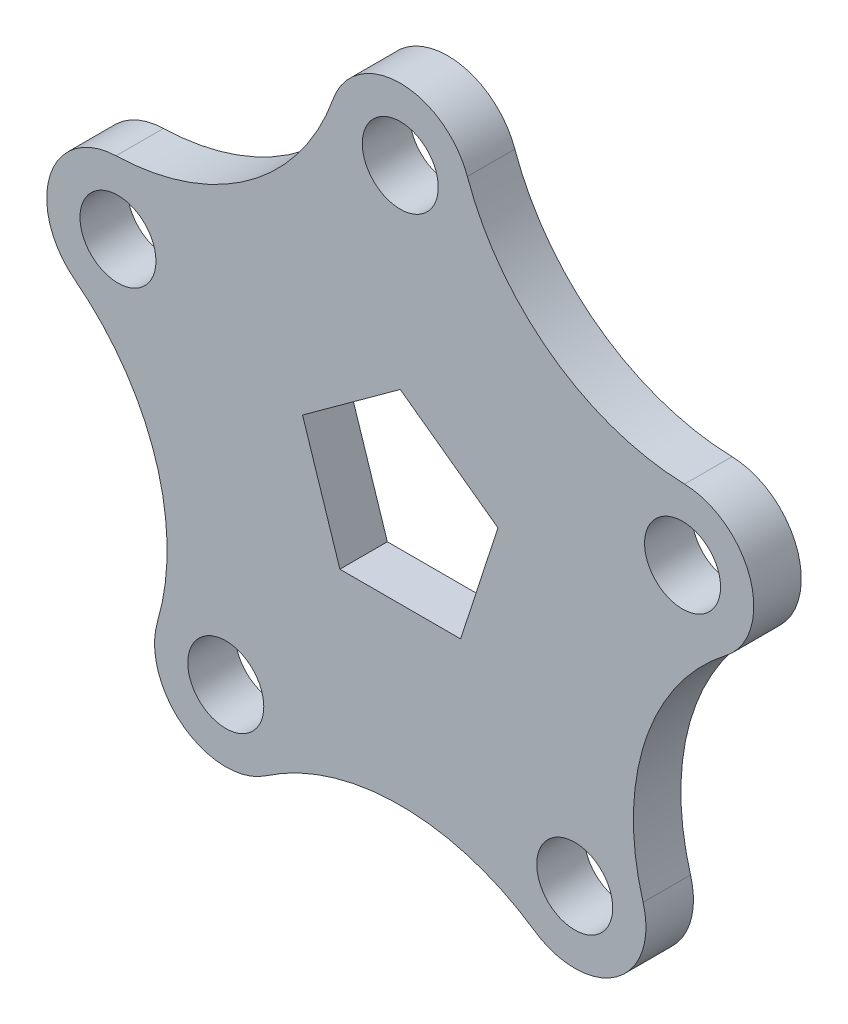
from build123d import *

# Parameters (mm, degrees)
DODANIE_WYCI_GNI_CIE1_DEPTH = 10


with BuildPart() as part:
    # Szkic1 → Dodanie-wyciągnięcie1 (new body)
    # profile 1 of 6: a face of its own
    with BuildSketch(Plane.XY):
        with BuildLine():
            ThreePointArc((49.451604439, -38.220267116), (51.534462525, -16.744561909), (62.47249774, 1.853921835))
            ThreePointArc((62.47249774, 1.853921835), (62.136733384, 6.728771384), (61.421159158, 11.562491416))
            ThreePointArc((61.421159158, 11.562491416), (51.832580138, 16.841426193), (56.487023507, 26.748199479))
            ThreePointArc((56.487023507, 26.748199479), (54.224745868, 31.079365108), (51.631020266, 35.220558574))
            ThreePointArc((51.631020266, 35.220558574), (31.850049433, 43.837832205), (17.541879041, 59.987769418))
            ThreePointArc((17.541879041, 59.987769418), (12.80186472, 61.174849895), (7.983599188, 61.988))
            ThreePointArc((7.983599188, 61.988), (0, 54.5), (-7.983599188, 61.988))
            ThreePointArc((-7.983599188, 61.988), (-12.80186472, 61.174849895), (-17.541879041, 59.987769418))
            ThreePointArc((-17.541879041, 59.987769418), (-31.850049433, 43.837832205), (-51.631020266, 35.220558574))
            ThreePointArc((-51.631020266, 35.220558574), (-54.224745868, 31.079365108), (-56.487023507, 26.748199479))
            ThreePointArc((-56.487023507, 26.748199479), (-52.821664093, 23.80621893), (-51.441032268, 19.313562148))
            ThreePointArc((-51.441032268, 19.313562148), (-54.533946326, 12.995294383), (-61.421159158, 11.562491416))
            ThreePointArc((-61.421159158, 11.562491416), (-62.136733384, 6.728771384), (-62.47249774, 1.853921835))
            ThreePointArc((-62.47249774, 1.853921835), (-51.534462525, -16.744561909), (-49.451604439, -38.220267116))
            ThreePointArc((-49.451604439, -38.220267116), (-46.314600697, -41.96674591), (-42.894499639, -45.456703584))
            ThreePointArc((-42.894499639, -45.456703584), (-34.022114322, -43.038159469), (-28.736578268, -50.563562148))
            ThreePointArc((-28.736578268, -50.563562148), (-29.052877736, -52.790835397), (-29.976764799, -54.84198731))
            ThreePointArc((-29.976764799, -54.84198731), (-25.600748462, -57.016240478), (-21.068247925, -58.841982711))
            ThreePointArc((-21.068247925, -58.841982711), (0, -54.186540592), (21.068247925, -58.841982711))
            ThreePointArc((21.068247925, -58.841982711), (25.600748462, -57.016240478), (29.976764799, -54.84198731))
            ThreePointArc((29.976764799, -54.84198731), (32.03429625, -44.091426193), (42.894499639, -45.456703584))
            ThreePointArc((42.894499639, -45.456703584), (46.314600697, -41.96674591), (49.451604439, -38.220267116))
        make_face()
        Polygon((-10.286241146, 14.15779796), (0, 21.631189606), (10.286241317, 14.157797836), (20.57248383, 6.684405197), (16.643488487, -5.40779909), (12.71449424, -17.5), (2.9e-08, -17.5), (-12.71449424, -17.5), (-16.643488373, -5.40779944), (-20.57248383, 6.684405197), align=None, mode=Mode.SUBTRACT)
    # profile 2 of 6: a face of its own
    with BuildSketch(Plane.XY):
        with BuildLine():
            ThreePointArc((-56.487023507, 26.748199479), (-54.224745868, 31.079365108), (-51.631020266, 35.220558574))
            ThreePointArc((-51.631020266, 35.220558574), (-55.724604264, 34.593732502), (-59.85601991, 34.307820558))
            ThreePointArc((-59.85601991, 34.307820558), (-73.706880013, 23.948817064), (-68.590168285, 7.426875892))
            ThreePointArc((-68.590168285, 7.426875892), (-65.415837641, 4.767183084), (-62.47249774, 1.853921835))
            ThreePointArc((-62.47249774, 1.853921835), (-62.136733384, 6.728771384), (-61.421159158, 11.562491416))
            ThreePointArc((-61.421159158, 11.562491416), (-67.049484399, 21.785698103), (-56.487023507, 26.748199479))
        make_face()
    # profile 3 of 6: a face of its own
    with BuildSketch(Plane.XY):
        with BuildLine():
            ThreePointArc((7.983599188, 61.988), (12.80186472, 61.174849895), (17.541879041, 59.987769418))
            ThreePointArc((17.541879041, 59.987769418), (15.680744996, 63.687299245), (14.132148934, 67.528157367))
            ThreePointArc((14.132148934, 67.528157367), (0, 77.5), (-14.132148934, 67.528157367))
            ThreePointArc((-14.132148934, 67.528157367), (-15.680744996, 63.687299245), (-17.541879041, 59.987769418))
            ThreePointArc((-17.541879041, 59.987769418), (-12.80186472, 61.174849895), (-7.983599188, 61.988))
            ThreePointArc((-7.983599188, 61.988), (-0.256131307, 70.495898746), (8, 62.5))
            ThreePointArc((8, 62.5), (7.995898746, 62.243868693), (7.983599188, 61.988))
        make_face()
    # profile 4 of 6: a face of its own
    with BuildSketch(Plane.XY):
        with BuildLine():
            ThreePointArc((61.421159158, 11.562491416), (62.136733384, 6.728771384), (62.47249774, 1.853921835))
            ThreePointArc((62.47249774, 1.853921835), (65.415837641, 4.767183084), (68.590168285, 7.426875892))
            ThreePointArc((68.590168285, 7.426875892), (73.706880013, 23.948817064), (59.85601991, 34.307820558))
            ThreePointArc((59.85601991, 34.307820558), (55.724604264, 34.593732502), (51.631020266, 35.220558574))
            ThreePointArc((51.631020266, 35.220558574), (54.224745868, 31.079365108), (56.487023507, 26.748199479))
            ThreePointArc((56.487023507, 26.748199479), (63.93368905, 25.932930324), (67.441032268, 19.313562148))
            ThreePointArc((67.441032268, 19.313562148), (65.759300034, 14.406476206), (61.421159158, 11.562491416))
        make_face()
    # profile 5 of 6: a face of its own
    with BuildSketch(Plane.XY):
        with BuildLine():
            ThreePointArc((51.125203669, -46.324758182), (50.120444441, -42.307196762), (49.451604439, -38.220267116))
            ThreePointArc((49.451604439, -38.220267116), (46.314600697, -41.96674591), (42.894499639, -45.456703584))
            ThreePointArc((42.894499639, -45.456703584), (44.261980947, -47.849098202), (44.736578268, -50.563562148))
            ThreePointArc((44.736578268, -50.563562148), (38.963851517, -58.247262681), (29.976764799, -54.84198731))
            ThreePointArc((29.976764799, -54.84198731), (25.600748462, -57.016240478), (21.068247925, -58.841982711))
            ThreePointArc((21.068247925, -58.841982711), (24.748466068, -60.741018069), (28.25890636, -62.938095635))
            ThreePointArc((28.25890636, -62.938095635), (45.553357053, -62.698817064), (51.125203669, -46.324758182))
        make_face()
    # profile 6 of 6: a face of its own
    with BuildSketch(Plane.XY):
        with BuildLine():
            ThreePointArc((-28.25890636, -62.938095635), (-24.748466068, -60.741018069), (-21.068247925, -58.841982711))
            ThreePointArc((-21.068247925, -58.841982711), (-25.600748462, -57.016240478), (-29.976764799, -54.84198731))
            ThreePointArc((-29.976764799, -54.84198731), (-41.438860287, -57.035698103), (-42.894499639, -45.456703584))
            ThreePointArc((-42.894499639, -45.456703584), (-46.314600697, -41.96674591), (-49.451604439, -38.220267116))
            ThreePointArc((-49.451604439, -38.220267116), (-50.120444441, -42.307196762), (-51.125203669, -46.324758182))
            ThreePointArc((-51.125203669, -46.324758182), (-45.553357053, -62.698817064), (-28.25890636, -62.938095635))
        make_face()
    extrude(amount=DODANIE_WYCI_GNI_CIE1_DEPTH)


solid = part.part
